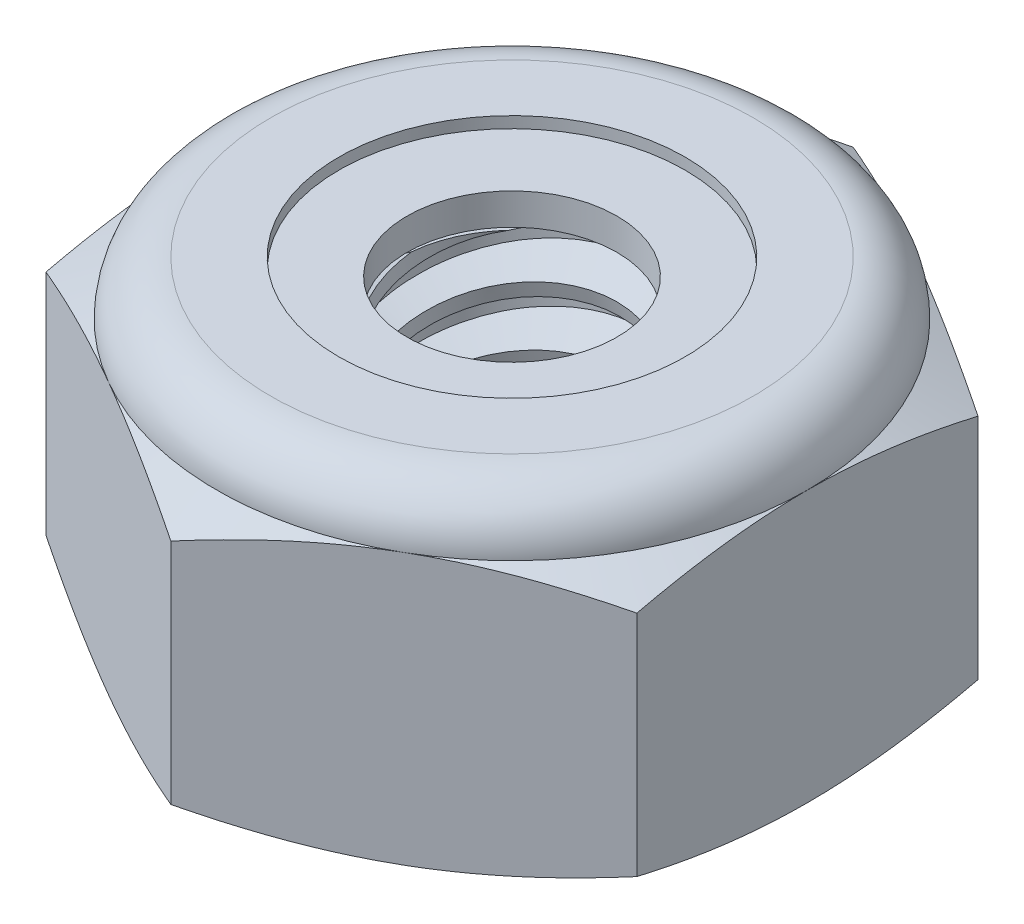
from build123d import *

# Parameters (mm, degrees)
EXTRUDE1_DEPTH      = 4.365625
SKETCH2_W           = 1.7526
SKETCH2_H           = 4.365625
LPATTERN1_COUNT     = 6
LPATTERN1_PITCH     = 0.79375
LPATTERN1_COL_COUNT = 2
LPATTERN1_COL_PITCH = 0.79375


with BuildPart() as part:
    # Sketch1 → Extrude1 (new body)
    with BuildSketch(Plane(origin=(0, 0, 0), x_dir=(1, 0, 0), z_dir=(0, 1, 0))):
        Polygon((0, 4.582717762), (-3.96875, 2.291358881), (-3.96875, -2.291358881), (0, -4.582717762), (3.96875, -2.291358881), (3.96875, 2.291358881), align=None)
    extrude(amount=EXTRUDE1_DEPTH)

    # Sketch4 → Cut-Revolve2 (revolve, cut)
    with BuildSketch(Plane(origin=(0, 0, 0), x_dir=(0, 0, -1), z_dir=(1, 0, 0)), mode=Mode.PRIVATE) as cut_revolve2_sk:
        Polygon((0, 4.365625), (1.7526, 4.365625), (1.410275607, 4.205996514), (1.410275607, 0.159628486), (1.7526, 0), (0, 0), align=None)
    revolve(cut_revolve2_sk.sketch.rotate(Axis((0, 4.365625, 0), (0, 1, 0)), 47.958361099), axis=Axis((0, 4.365625, 0), (0, 1, 0)), mode=Mode.SUBTRACT)


with BuildPart() as body_2:
    # Sketch2 → Revolve1 (revolve)
    with BuildSketch(Plane(origin=(0, 0, 0), x_dir=(0, 0, -1), z_dir=(1, 0, 0))):
        with Locations((0.8763, 2.1828125)):
            Rectangle(SKETCH2_W, SKETCH2_H)
    revolve(axis=Axis((0, -1.7526, 0), (0, 1, 0)))

    # Sketch3 → Cut-Revolve1 (revolve, cut)
    with BuildSketch(Plane(origin=(0, 0, 0), x_dir=(0, 0, -1), z_dir=(1, 0, 0)), mode=Mode.PRIVATE) as cut_revolve1_sk:
        Polygon((1.774513192, 4.268856346), (1.927905533, 3.591475768), (1.454101991, 3.7385105), (1.410275607, 3.932047808), align=None)
    cut_revolve1 = revolve(cut_revolve1_sk.sketch.rotate(Axis((0, 4.365625, 0.193538035), (0, -0.975306118536993, -0.22085736379913826)), 180), axis=Axis((0, 4.365625, 0.193538035), (0, -0.975306118536993, -0.22085736379913826)), mode=Mode.SUBTRACT)

    # LPattern1: Cut-Revolve1 ×6
    with Locations(*[(0, -i * LPATTERN1_PITCH, 0) for i in range(1, LPATTERN1_COUNT)]):
        add(cut_revolve1, mode=Mode.SUBTRACT)

    # LPattern1 col: Cut-Revolve1 ×2
    with Locations(*[(0, i * LPATTERN1_COL_PITCH, 0) for i in range(1, LPATTERN1_COL_COUNT)]):
        add(cut_revolve1, mode=Mode.SUBTRACT)


with BuildPart() as part_1:
    add(part.part)

    # Combine1: cut body 2
    add(body_2.part, mode=Mode.SUBTRACT)

    # Sketch5 → Cut-Revolve3 (revolve, cut)
    with BuildSketch(Plane(origin=(0, 0, 0), x_dir=(0, 0, -1), z_dir=(1, 0, 0)), mode=Mode.PRIVATE) as cut_revolve3_sk:
        with BuildLine():
            Line((0, 0), (3.96875, 0))
            Line((3.96875, 0), (4.582717762, 0.286297869))
            Line((4.582717762, 0.286297869), (4.582717762, 3.351722964))
            Line((4.582717762, 3.351722964), (3.96875, 3.638020833))
            ThreePointArc((3.96875, 3.638020833), (3.755639674, 4.152514674), (3.241145833, 4.365625))
            Line((3.241145833, 4.365625), (3.241145833, 5.635625))
            Line((3.241145833, 5.635625), (5.852717762, 5.635625))
            Line((5.852717762, 5.635625), (5.852717762, -1.27))
            Line((5.852717762, -1.27), (0, -1.27))
            Line((0, -1.27), (0, 0))
        make_face()
    revolve(cut_revolve3_sk.sketch.rotate(Axis((0, 0, 0), (0, 1, 0)), 47.958361099), axis=Axis((0, 0, 0), (0, 1, 0)), mode=Mode.SUBTRACT)

    # Sketch6 → Cut-Revolve4 (revolve, cut)
    with BuildSketch(Plane(origin=(0, 0, 0), x_dir=(0, 0, -1), z_dir=(1, 0, 0)), mode=Mode.PRIVATE) as cut_revolve4_sk:
        with BuildLine():
            Line((0, 3.638020833), (3.81635, 3.638020833))
            ThreePointArc((3.81635, 3.638020833), (3.6478766, 4.0447516), (3.241145833, 4.213225))
            Line((3.241145833, 4.213225), (2.32571072, 4.213225))
            Line((2.32571072, 4.213225), (2.32571072, 5.635625))
            Line((2.32571072, 5.635625), (0, 5.635625))
            Line((0, 5.635625), (0, 3.638020833))
        make_face()
    revolve(cut_revolve4_sk.sketch.rotate(Axis((0, 5.635625, 0), (0, 1, 0)), 11.653123147), axis=Axis((0, 5.635625, 0), (0, 1, 0)), mode=Mode.SUBTRACT)


with BuildPart() as body_2_2:
    # Sketch7 → Revolve2 (revolve)
    with BuildSketch(Plane(origin=(0, 0, 0), x_dir=(0, 0, -1), z_dir=(1, 0, 0))):
        with BuildLine():
            Line((1.410275607, 3.714220833), (3.734297654, 3.714220833))
            ThreePointArc((3.734297654, 3.714220833), (3.565938876, 4.016854092), (3.241145833, 4.137025))
            Line((3.241145833, 4.137025), (1.410275607, 4.137025))
            Line((1.410275607, 4.137025), (1.410275607, 3.714220833))
        make_face()
    revolve(axis=Axis((0, 3.714220833, 0), (0, 1, 0)))


solid = Compound([part_1.part, body_2_2.part])
